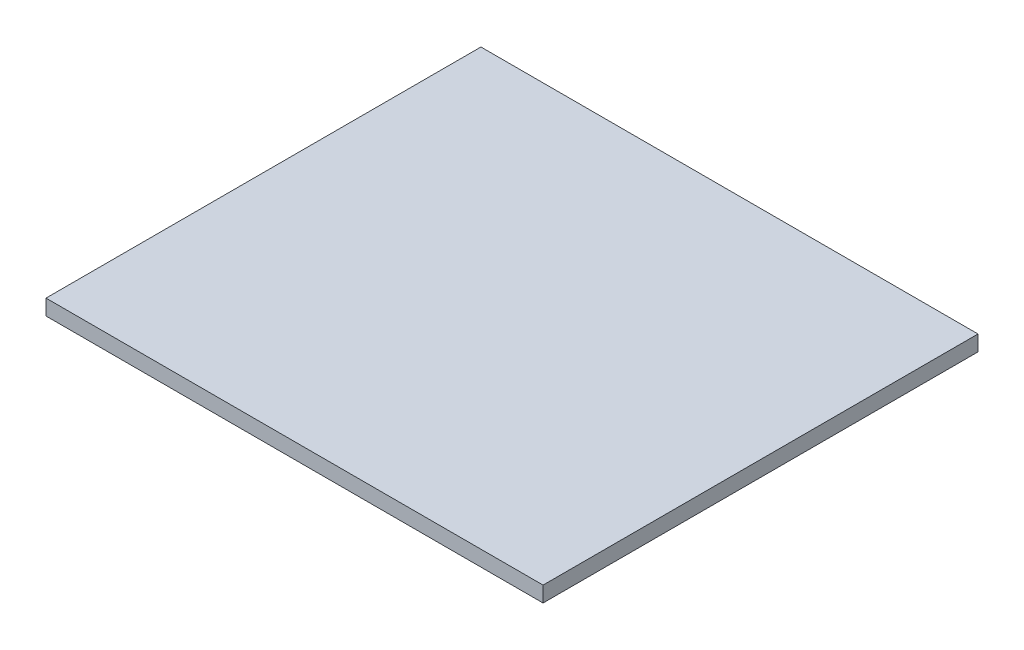
from build123d import *

# Parameters (mm, degrees)
SKETCH1_W           = 406.4
SKETCH1_H           = 355.6
BOSS_EXTRUDE1_DEPTH = 12.7


with BuildPart() as part:
    # Sketch1 → Boss-Extrude1 (new body)
    with BuildSketch(Plane(origin=(0, 0, 0), x_dir=(1, 0, 0), z_dir=(0, 1, 0))):
        Rectangle(SKETCH1_W, SKETCH1_H)
    extrude(amount=BOSS_EXTRUDE1_DEPTH)


solid = part.part
